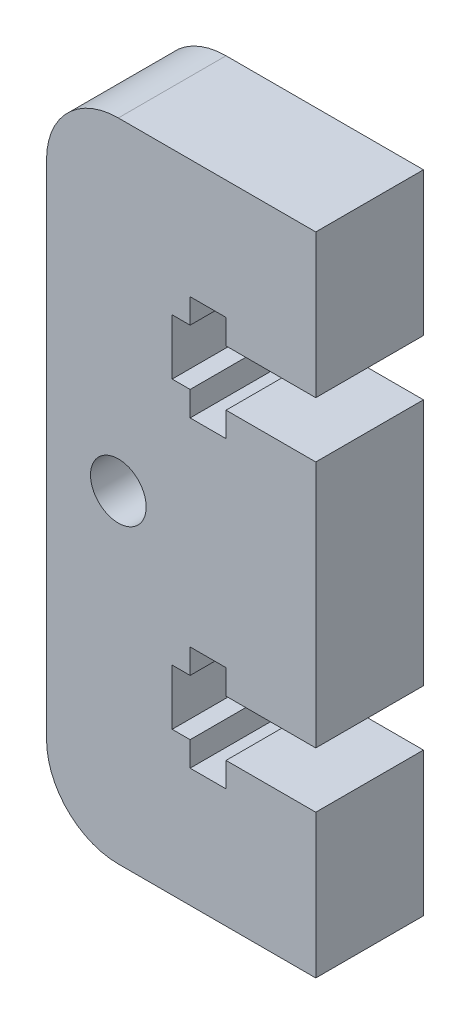
from build123d import *

# Parameters (mm, degrees)
DODANIE_WYCI_GNI_CIE1_DEPTH = 6
WYTNIJ_WYCI_GNI_CIE1_DEPTH  = 15
SZYK_LINIOWY1_COUNT         = 2
SZYK_LINIOWY1_PITCH         = 16.9
SZKIC3_R                    = 1.55
WYTNIJ_WYCI_GNI_CIE2_DEPTH  = 15


with BuildPart() as part:
    # Szkic1 → Dodanie-wyciągnięcie1 (new body)
    with BuildSketch(Plane(origin=(302.151296802, 0, 0), x_dir=(-1, 0, 0), z_dir=(0, 0, -1))):
        with BuildLine():
            Line((-882.390597923, 236.727796113), (-882.390597923, 200.727796113))
            Line((-882.390597923, 200.727796113), (-871.390597923, 200.727796113))
            ThreePointArc((-871.390597923, 200.727796113), (-868.562170798, 201.899368988), (-867.390597923, 204.727796113))
            Line((-867.390597923, 204.727796113), (-867.390597923, 232.727796113))
            ThreePointArc((-867.390597923, 232.727796113), (-868.562170798, 235.556223238), (-871.390597923, 236.727796113))
            Line((-871.390597923, 236.727796113), (-882.390597923, 236.727796113))
        make_face()
    extrude(amount=DODANIE_WYCI_GNI_CIE1_DEPTH)

    # Szkic2 → Wytnij-wyciągnięcie1 (cut)
    with BuildSketch(Plane(origin=(1169.541894725, 0, -6), x_dir=(1, 0, 0), z_dir=(0, 0, 1))):
        Polygon((15, 228.727796113), (15, 225.627796113), (10, 225.627796113), (10, 224.252796113), (8, 224.252796113), (8, 225.627796113), (7, 225.627796113), (7, 228.727796113), (8, 228.727796113), (8, 230.102796113), (10, 230.102796113), (10, 228.727796113), align=None)
    wytnij_wyci_gni_cie1 = extrude(amount=WYTNIJ_WYCI_GNI_CIE1_DEPTH, mode=Mode.SUBTRACT)

    # Szyk liniowy1: Wytnij-wyciągnięcie1 ×2
    with Locations(*[(0, -i * SZYK_LINIOWY1_PITCH, 0) for i in range(1, SZYK_LINIOWY1_COUNT)]):
        add(wytnij_wyci_gni_cie1, mode=Mode.SUBTRACT)

    # Szkic3 → Wytnij-wyciągnięcie2 (cut)
    with BuildSketch(Plane(origin=(0, 0, -6), x_dir=(-1, 0, 0), z_dir=(0, 0, -1))):
        with Locations((-1173.541894725, 218.727796113)):
            Circle(SZKIC3_R)
    extrude(amount=-WYTNIJ_WYCI_GNI_CIE2_DEPTH, mode=Mode.SUBTRACT)


solid = part.part
